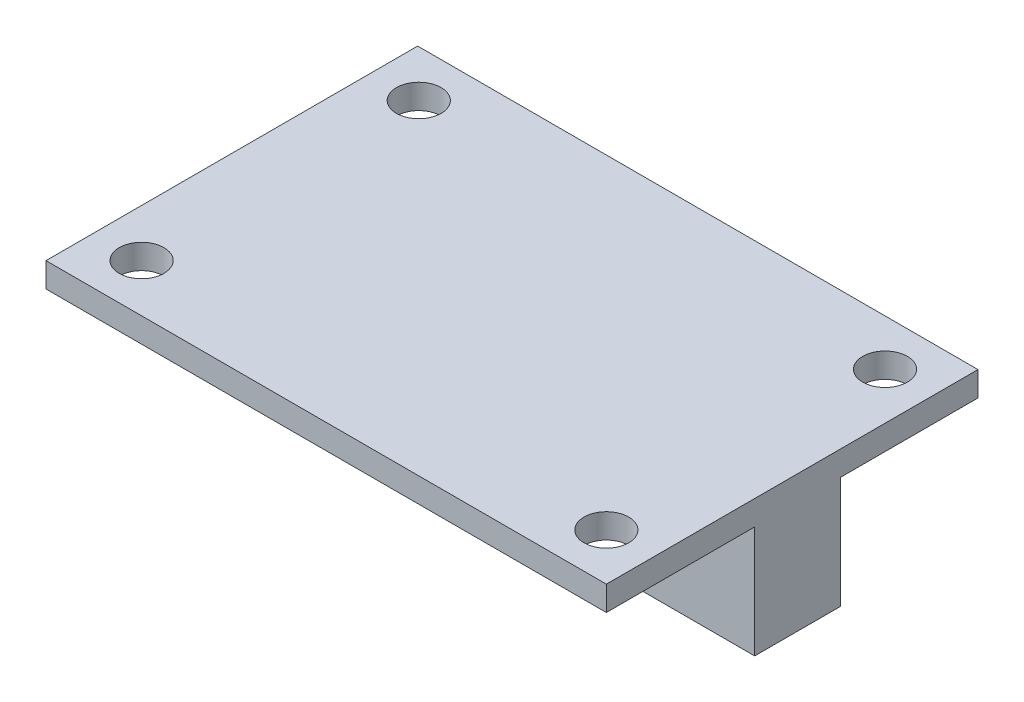
from build123d import *

# Parameters (mm, degrees)
SKETCH1_W           = 38.200952294
SKETCH1_H           = 25.337366318
BOSS_EXTRUDE1_DEPTH = 1.6764
SKETCH2_R           = 1.524
CUT_EXTRUDE1_DEPTH  = 1.6764
SKETCH5_W           = 7.761339033
SKETCH5_H           = 5.842
BOSS_EXTRUDE2_DEPTH = 7.62


with BuildPart() as part:
    # Sketch1 → Boss-Extrude1 (new body)
    with BuildSketch(Plane(origin=(0, 0, 0), x_dir=(1, 0, 0), z_dir=(0, 1, 0))):
        Rectangle(SKETCH1_W, SKETCH1_H)
    extrude(amount=BOSS_EXTRUDE1_DEPTH)

    # Sketch2 → Cut-Extrude1 (cut)
    with BuildSketch(Plane(origin=(0, 1.6764, 0), x_dir=(1, 0, 0), z_dir=(0, 1, 0))):
        with Locations(Location((-15.849276147, -9.404783159, 0), (0, 0, 270))):
            Circle(SKETCH2_R)
        with Locations(Location((-15.849276147, 9.493683159, 0), (0, 0, 270))):
            Circle(SKETCH2_R)
        with Locations(Location((15.912776147, 9.519083159, 0), (0, 0, 270))):
            Circle(SKETCH2_R)
        with Locations(Location((15.900076147, -9.468283159, 0), (0, 0, 270))):
            Circle(SKETCH2_R)
    extrude(amount=-CUT_EXTRUDE1_DEPTH, mode=Mode.SUBTRACT)

    # Sketch5 → Boss-Extrude2 (add)
    with BuildSketch(Plane.XZ):
        with Locations((15.219806631, -0.36511235)):
            Rectangle(SKETCH5_W, SKETCH5_H)
    extrude(amount=BOSS_EXTRUDE2_DEPTH)


solid = part.part
